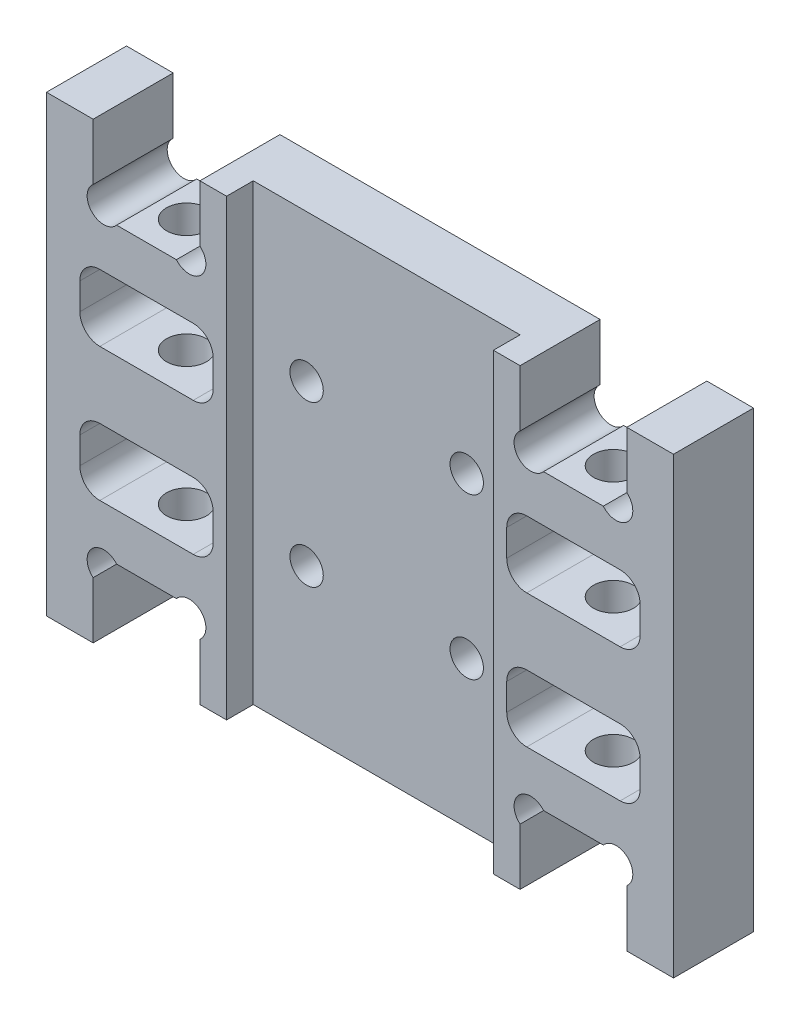
from build123d import *

# Parameters (mm, degrees)
EXTRUDE_1_DEPTH      = 6
SKETCH_2_W           = 10
SKETCH_2_H           = 5
CUT_EXTRUDE_1_DEPTH  = 31.822070015
SKETCH_3_R           = 1.5
CUT_EXTRUDE_2_DEPTH  = 39.013155617
SKETCH_4_W           = 20
SKETCH_4_H           = 34
CUT_EXTRUDE_3_DEPTH  = 2
SKETCH_5_R           = 1.25
CUT_EXTRUDE_4_DEPTH  = 31.495901364
FILLET_2_R           = 1.5
SKETCH_9_W           = 1.5
SKETCH_9_H           = 35
CUT_EXTRUDE_10_DEPTH = 31.822070015
SKETCH_10_W          = 2
SKETCH_10_H          = 6
EXTRUDE_2_DEPTH      = 6
SKETCH_11_R          = 1.25
CUT_EXTRUDE_11_DEPTH = 30.618406439


with BuildPart() as part:
    # 草图1 → 凸台-拉伸1 (new body)
    with BuildSketch(Plane.XY):
        Polygon((-25, -17), (-25, 17), (-22, 17), (-22, 11), (-12, 11), (-12, 17), (12, 17), (12, 11), (22, 11), (22, 17), (25, 17), (25, -17), (22, -17), (22, -11), (12, -11), (12, -17), (-12, -17), (-12, -11), (-22, -11), (-22, -17), align=None)
    extrude(amount=EXTRUDE_1_DEPTH)

    # 草图2 → 切除-拉伸1 (cut, through all)
    with BuildSketch(Plane.XY.offset(6)):
        with Locations((-16, 5)):
            Rectangle(SKETCH_2_W, SKETCH_2_H)
        with Locations((-16, -5)):
            Rectangle(SKETCH_2_W, SKETCH_2_H)
        with Locations((16, -5)):
            Rectangle(SKETCH_2_W, SKETCH_2_H)
        with Locations((16, 5)):
            Rectangle(SKETCH_2_W, SKETCH_2_H)
    extrude(amount=-CUT_EXTRUDE_1_DEPTH, mode=Mode.SUBTRACT)

    # 草图3 → 切除-拉伸2 (cut, through all)
    with BuildSketch(Plane.XZ.offset(11)):
        with Locations(Location((-16, 3, 0), (0, 0, 270))):
            Circle(SKETCH_3_R)
        with Locations(Location((16, 3, 0), (0, 0, 270))):
            Circle(SKETCH_3_R)
    extrude(amount=-CUT_EXTRUDE_2_DEPTH, mode=Mode.SUBTRACT)

    # 草图4 → 切除-拉伸3 (cut)
    with BuildSketch(Plane.XY.offset(6)):
        Rectangle(SKETCH_4_W, SKETCH_4_H)
    extrude(amount=-CUT_EXTRUDE_3_DEPTH, mode=Mode.SUBTRACT)

    # 草图5 → 切除-拉伸4 (cut, through all)
    with BuildSketch(Plane.XY.offset(4)):
        with Locations((-6, 6)):
            Circle(SKETCH_5_R)
        with Locations((6, 6)):
            Circle(SKETCH_5_R)
        with Locations((-6, -6)):
            Circle(SKETCH_5_R)
        with Locations((6, -6)):
            Circle(SKETCH_5_R)
    extrude(amount=-CUT_EXTRUDE_4_DEPTH, mode=Mode.SUBTRACT)

    # 圆角2
    fillet_2_edges = [part.edges().sort_by_distance(p)[0] for p in [
        (-11, 7.5, 3),
        (-11, 2.5, 3),
        (-21, 2.5, 3),
        (-21, 7.5, 3),
        (-21, -7.5, 3),
        (-21, -2.5, 3),
        (-11, -2.5, 3),
        (-11, -7.5, 3),
        (21, -2.5, 3),
        (21, -7.5, 3),
        (11, -7.5, 3),
        (11, -2.5, 3),
        (21, 7.5, 3),
        (21, 2.5, 3),
        (11, 2.5, 3),
        (11, 7.5, 3),
    ]]
    fillet(fillet_2_edges, radius=FILLET_2_R)

    # 草图9 → 切除-拉伸10 (cut, through all)
    with BuildSketch(Plane.XY.offset(6)):
        with Locations((-24.25, -0.5)):
            Rectangle(SKETCH_9_W, SKETCH_9_H)
        with Locations((24.25, -0.5)):
            Rectangle(SKETCH_9_W, SKETCH_9_H)
    extrude(amount=-CUT_EXTRUDE_10_DEPTH, mode=Mode.SUBTRACT)

    # 草图10 → 凸台-拉伸2 (add)
    with BuildSketch(Plane.XY.offset(6)):
        with Locations((-21, 14)):
            Rectangle(SKETCH_10_W, SKETCH_10_H)
        with Locations((21, 14)):
            Rectangle(SKETCH_10_W, SKETCH_10_H)
        with Locations((21, -14)):
            Rectangle(SKETCH_10_W, SKETCH_10_H)
        with Locations((-21, -14)):
            Rectangle(SKETCH_10_W, SKETCH_10_H)
    extrude(amount=-EXTRUDE_2_DEPTH)

    # 草图11 → 切除-拉伸11 (cut, through all)
    with BuildSketch(Plane.XY.offset(6)):
        with Locations((-19.2, 11.8)):
            Circle(SKETCH_11_R)
        with Locations((-12.8, 11.8)):
            Circle(SKETCH_11_R)
        with Locations((12.8, 11.8)):
            Circle(SKETCH_11_R)
        with Locations((19.2, 11.8)):
            Circle(SKETCH_11_R)
        with Locations((19.2, -11.8)):
            Circle(SKETCH_11_R)
        with Locations((12.8, -11.8)):
            Circle(SKETCH_11_R)
        with Locations((-12.8, -11.8)):
            Circle(SKETCH_11_R)
        with Locations((-19.2, -11.8)):
            Circle(SKETCH_11_R)
    extrude(amount=-CUT_EXTRUDE_11_DEPTH, mode=Mode.SUBTRACT)


solid = part.part
